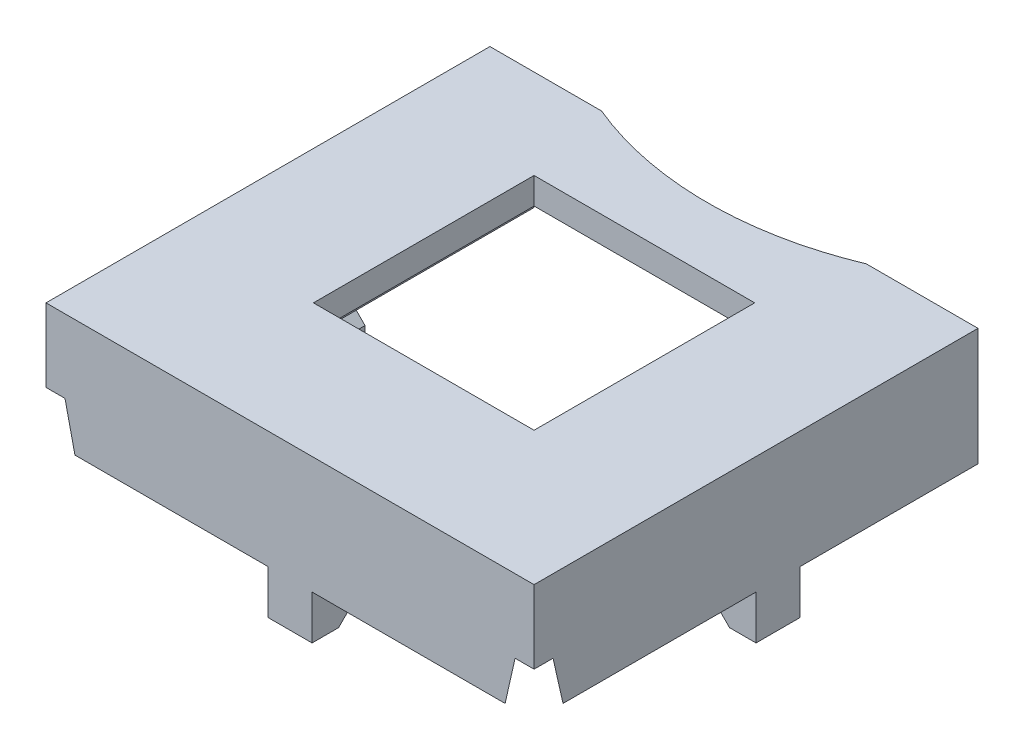
from build123d import *

# Parameters (mm, degrees)
SKETCH1_W                    = 45.3
SKETCH1_H                    = 45.3
SKETCH1_W_2                  = 25
SKETCH1_H_2                  = 25
BOSS_EXTRUDE1_DEPTH          = 3
BOSS_EXTRUDE2_DEPTH          = 10.3
BOSS_EXTRUDE3_DEPTH          = 2.5
CIRPATTERN1_COUNT            = 3
CIRPATTERN1_ANGLE            = 180
CUT_EXTRUDE1_DEPTH           = 5
CUT_EXTRUDE1_DRAFT           = -10
CUT_EXTRUDE1_PROFILE_2_DEPTH = 5
CUT_EXTRUDE1_PROFILE_2_DRAFT = -10
CUT_EXTRUDE2_REACH           = 45.173


with BuildPart() as part:
    # Sketch1 → Boss-Extrude1 (new body)
    # profile 1 of 2: a face of its own
    with BuildSketch(Plane(origin=(0, 0, 0), x_dir=(1, 0, 0), z_dir=(0, 1, 0))):
        Polygon((-27.65, 22.65), (-22.65, 22.65), (-22.65, -22.65), (22.65, -22.65), (22.65, 22.65), (27.65, 22.65), (27.65, -27.65), (-27.65, -27.65), align=None)
    # profile 2 of 2: a face of its own
    with BuildSketch(Plane(origin=(0, 0, 0), x_dir=(1, 0, 0), z_dir=(0, 1, 0))):
        Rectangle(SKETCH1_W, SKETCH1_H)
        Rectangle(SKETCH1_W_2, SKETCH1_H_2, mode=Mode.SUBTRACT)
    extrude(amount=BOSS_EXTRUDE1_DEPTH)

    # Sketch1<3> → Boss-Extrude2 (add)
    with BuildSketch(Plane(origin=(0, 0, 0), x_dir=(1, 0, 0), z_dir=(0, 1, 0))):
        Polygon((-27.65, 22.65), (-22.65, 22.65), (-22.65, -22.65), (22.65, -22.65), (22.65, 22.65), (27.65, 22.65), (27.65, -27.65), (-27.65, -27.65), align=None)
    extrude(amount=-BOSS_EXTRUDE2_DEPTH)

    # Sketch2 → Boss-Extrude3 (add, symmetric)
    with BuildSketch(Plane(origin=(0, 0, 0), x_dir=(-1, 0, 0), z_dir=(0, 0, -1))):
        Polygon((-21.65, -12.3), (-24.65, -15.3), (-27.65, -15.3), (-27.65, -10.3), (-22.65, -10.3), (-21.65, -11.3), align=None)
    boss_extrude3 = extrude(amount=BOSS_EXTRUDE3_DEPTH, both=True)

    # CirPattern1: Boss-Extrude3 ×3 about axis
    cirpattern1_axis = Axis((0, 0, 0), (0, -1, 0))
    for i in range(1, CIRPATTERN1_COUNT):
        add(boss_extrude3.rotate(cirpattern1_axis, i * CIRPATTERN1_ANGLE / (CIRPATTERN1_COUNT - 1)))


with BuildPart() as cut_extrude1_tool:
    # Sketch3 → Cut-Extrude1 (with draft: the straight prism first)
    with BuildSketch(Plane.XZ.offset(10.3)):
        Polygon((21.65, 21.65), (21.65, 19.569375153), (28.65, 25.169375153), (28.65, 28.65), (25.169375153, 28.65), (19.569375153, 21.65), align=None)
    extrude(amount=-CUT_EXTRUDE1_DEPTH)
    # Cut-Extrude1: the draft: its side faces are tilted about the plane it starts from
    cut_extrude1_sides = [cut_extrude1_tool.faces().sort_by_distance(p)[0] for p in [
        (21.65, -7.8, 20.609687576),
        (25.15, -7.8, 22.369375153),
        (28.65, -7.8, 26.909687576),
        (26.909687576, -7.8, 28.65),
        (22.369375153, -7.8, 25.15),
        (20.609687576, -7.8, 21.65),
    ]]
    draft(cut_extrude1_sides, Plane.XZ.offset(10.3), CUT_EXTRUDE1_DRAFT)


with BuildPart() as part_1:
    add(part.part)

    # Cut-Extrude1: cut by cut_extrude1_tool
    add(cut_extrude1_tool.part, mode=Mode.SUBTRACT)


with BuildPart() as cut_extrude1_profile_2_tool:
    # Sketch3 → Cut-Extrude1 profile 2 (with draft: the straight prism first)
    with BuildSketch(Plane.XZ.offset(10.3)):
        Polygon((-21.65, 19.569375153), (-21.65, 21.65), (-19.569375153, 21.65), (-25.169375153, 28.65), (-28.65, 28.65), (-28.65, 25.169375153), align=None)
    extrude(amount=-CUT_EXTRUDE1_PROFILE_2_DEPTH)
    # Cut-Extrude1 profile 2: the draft: its side faces are tilted about the plane it starts from
    cut_extrude1_profile_2_sides = [cut_extrude1_profile_2_tool.faces().sort_by_distance(p)[0] for p in [
        (-21.65, -7.8, 20.609687576),
        (-20.609687576, -7.8, 21.65),
        (-22.369375153, -7.8, 25.15),
        (-26.909687576, -7.8, 28.65),
        (-28.65, -7.8, 26.909687576),
        (-25.15, -7.8, 22.369375153),
    ]]
    draft(cut_extrude1_profile_2_sides, Plane.XZ.offset(10.3), CUT_EXTRUDE1_PROFILE_2_DRAFT)


with BuildPart() as part_2:
    add(part_1.part)

    # Cut-Extrude1 profile 2: cut by cut_extrude1_profile_2_tool
    add(cut_extrude1_profile_2_tool.part, mode=Mode.SUBTRACT)

    # Sketch5 → Cut-Extrude2 (cut, up to next)
    with BuildSketch(Plane(origin=(0, 3, 0), x_dir=(1, 0, 0), z_dir=(0, 1, 0)), mode=Mode.PRIVATE) as cut_extrude2_sk1:
        with BuildLine():
            Line((15, 22.65), (-15, 22.65))
            ThreePointArc((-15, 22.65), (0, 19.65), (15, 22.65))
        make_face()
    cut_extrude2_tool1 = extrude(cut_extrude2_sk1.sketch, amount=-CUT_EXTRUDE2_REACH, mode=Mode.PRIVATE) & part_2.part
    add(cut_extrude2_tool1.solids().sort_by_distance((0, 3, -21.445954))[0], mode=Mode.SUBTRACT)


solid = part_2.part
